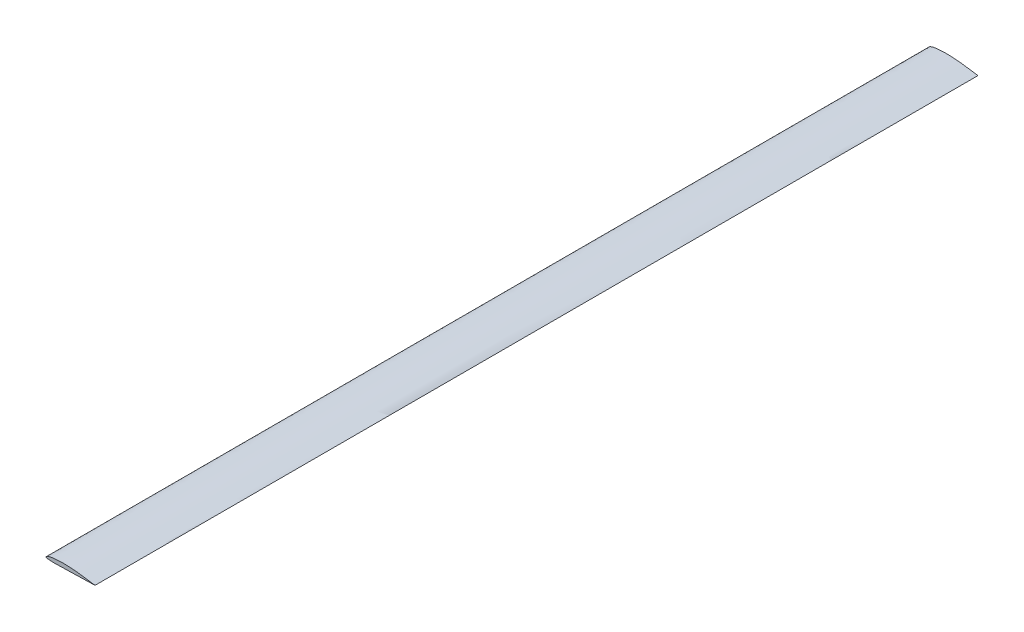
from build123d import *

# Parameters (mm, degrees)
BOSS_EXTRUDE1_DEPTH = 1800
SKETCH2_W           = 90
SKETCH2_H           = 10
BOSS_EXTRUDE2_DEPTH = 5


with BuildPart() as part:
    # Sketch1 → Boss-Extrude1 (new body)
    with BuildSketch(Plane.XY):
        with BuildLine():
            add(Edge.make_bspline(
                [(100, 0), (100.000254641, 0.004845584), (99.304368018, 0.065917243), (98.602194416, 0.166377019), (96.918548009, 0.388906995), (94.882959291, 0.699750822), (92.267553215, 1.109728308), (89.230970093, 1.598621483), (85.784625506, 2.150171121), (81.991508296, 2.741960863), (77.895435059, 3.349338965), (73.540645911, 3.942231232), (68.967678492, 4.499522691), (64.217981973, 5.009680255), (59.33721716, 5.464479685), (54.377842329, 5.863564685), (49.394282953, 6.199245733), (44.437634279, 6.450310336), (39.556895274, 6.60960139), (34.799140518, 6.677534608), (30.208636358, 6.641921756), (25.827546213, 6.498459774), (21.695092828, 6.259238297), (17.849019413, 5.919154653), (14.322575687, 5.480857732), (11.143035012, 4.953429067), (8.33415766, 4.3478015), (5.915253903, 3.675251181), (3.900930283, 2.954526905), (2.297632946, 2.206091575), (1.117458692, 1.462157989), (0.456151921, 0.873206714), (0.179984342, 0.478870117), (0.08162915, 0.304427913), (0.020899686, 0.147654194), (-0.003086424, 0.024059813), (0.001743624, -0.073331826), (0.049440185, -0.160757084), (0.138835818, -0.260917631), (0.282100942, -0.377094962), (0.628837255, -0.592457482), (1.401022687, -0.907219246), (2.756187628, -1.256343307), (4.674914494, -1.575469512), (7.077934896, -1.83641871), (9.94833589, -2.030821633), (13.262418406, -2.15868704), (16.991220889, -2.221308928), (21.099338047, -2.223982463), (25.5455259, -2.173571095), (30.282881122, -2.077862804), (35.259698034, -1.944513684), (40.420676002, -1.781129419), (45.707640095, -1.595299131), (51.060576984, -1.393846441), (56.41812222, -1.184958105), (61.718081929, -0.975290493), (66.897999702, -0.773239464), (71.895683892, -0.584753469), (76.650033275, -0.416097546), (81.102008532, -0.27169971), (85.192790487, -0.156956037), (88.872110363, -0.072922602), (92.075504751, -0.018297162), (94.797963391, 0.008620562), (96.888108734, 0.019123581), (98.594495014, 0.008422548), (99.303002177, 0.017964204), (99.999745129, -0.00484996), (100, 0)],
                knots=[0, 0, 0, 0, 0.00163101, 0.006435235, 0.014220669, 0.024765625, 0.037826727, 0.053149348, 0.070473504, 0.089535694, 0.110075428, 0.131859875, 0.154692567, 0.178371256, 0.202679512, 0.227363961, 0.252132687, 0.276728351, 0.300939435, 0.324527111, 0.347267377, 0.368991726, 0.389507471, 0.40862838, 0.426224009, 0.442178728, 0.456395551, 0.468805124, 0.479372318, 0.488085518, 0.494967924, 0.50003381, 0.501035663, 0.50209449, 0.502996978, 0.50351288, 0.503955826, 0.504408894, 0.504955423, 0.505942626, 0.507129614, 0.510997735, 0.518231919, 0.527845532, 0.539808758, 0.554055915, 0.570489592, 0.588973674, 0.609342058, 0.631392897, 0.654894034, 0.679589725, 0.705203145, 0.731446604, 0.758020282, 0.784619628, 0.810935624, 0.836656653, 0.861473352, 0.885081475, 0.907187944, 0.927507338, 0.945765257, 0.961711874, 0.975121793, 0.985796266, 0.993581185, 0.998367518, 1, 1, 1, 1], degree=3))
        make_face()
    extrude(amount=BOSS_EXTRUDE1_DEPTH)

    # Sketch2 → Boss-Extrude2 (add)
    with BuildSketch(Plane(origin=(0, 0, 0), x_dir=(1, 0, 0), z_dir=(0, 1, 0))):
        with Locations((49.999904345, -900)):
            Rectangle(SKETCH2_W, SKETCH2_H)
    extrude(amount=-BOSS_EXTRUDE2_DEPTH)


solid = part.part
